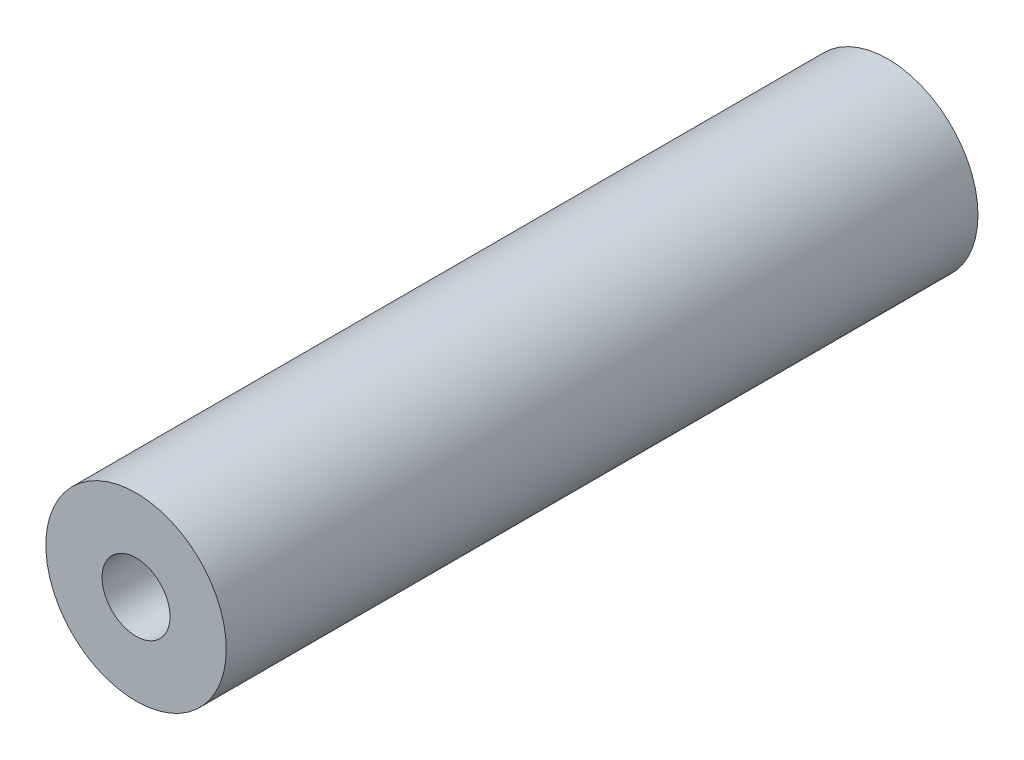
from build123d import *

# Parameters (mm, degrees)
SKETCH1_R           = 30
SKETCH1_R_2         = 11.3
BOSS_EXTRUDE1_DEPTH = 250


with BuildPart() as part:
    # Sketch1 → Boss-Extrude1 (new body)
    with BuildSketch(Plane.XY):
        Circle(SKETCH1_R)
        Circle(SKETCH1_R_2, mode=Mode.SUBTRACT)
    extrude(amount=BOSS_EXTRUDE1_DEPTH)


solid = part.part
